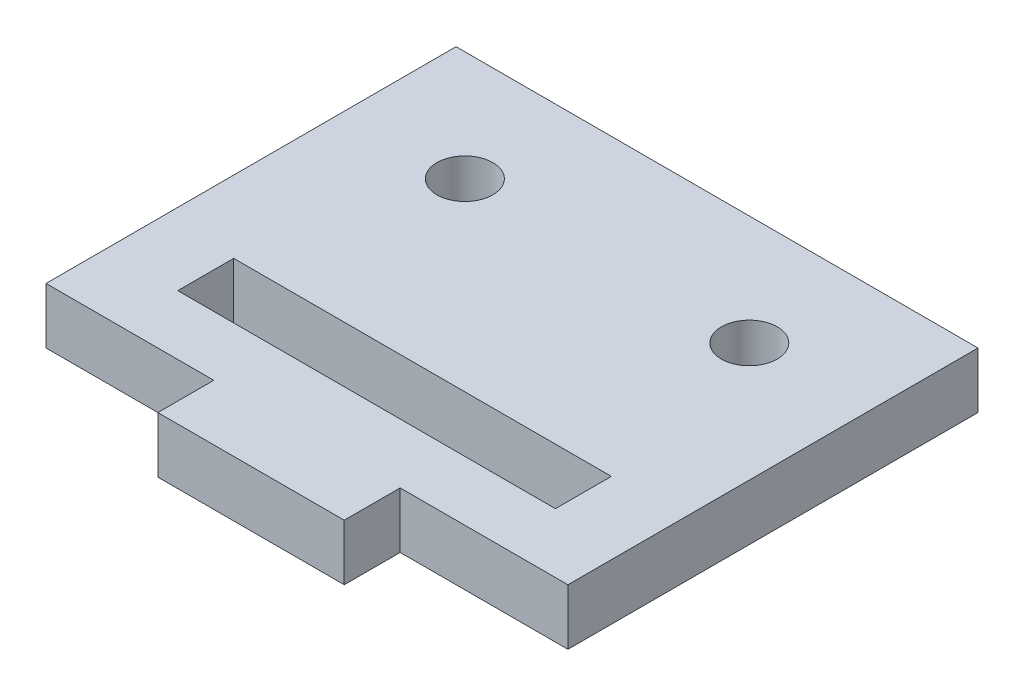
from build123d import *

# Parameters (mm, degrees)
SKETCH1_R           = 1.5
SKETCH1_W           = 20.26
SKETCH1_H           = 3
BOSS_EXTRUDE1_DEPTH = 3


with BuildPart() as part:
    # Sketch1 → Boss-Extrude1 (new body)
    with BuildSketch(Plane(origin=(0, 0, 0), x_dir=(1, 0, 0), z_dir=(0, 1, 0))):
        Polygon((-5, 0), (5, 0), (5, 3), (14, 3), (14, 25), (-14, 25), (-14, 3), (-5, 3), align=None)
        with Locations(Location((7.63, 19.1, 0), (0, 0, 270))):
            Circle(SKETCH1_R, mode=Mode.SUBTRACT)
        with Locations(Location((-7.63, 19.1, 0), (0, 0, 90))):
            Circle(SKETCH1_R, mode=Mode.SUBTRACT)
        with Locations((0, 7.7)):
            Rectangle(SKETCH1_W, SKETCH1_H, mode=Mode.SUBTRACT)
    extrude(amount=BOSS_EXTRUDE1_DEPTH)


solid = part.part
